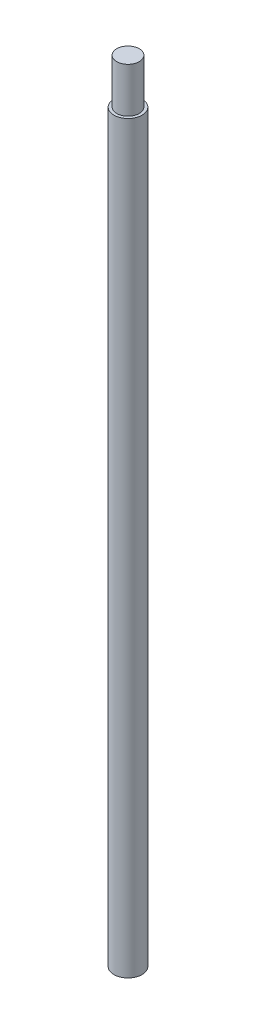
from build123d import *

# Parameters (mm, degrees)
SKETCH_1_R          = 5
EXTRUDE_1_DEPTH     = 281
SKETCH_2_R          = 16
SKETCH_2_R_2        = 4
CUT_EXTRUDE_1_DEPTH = 16


with BuildPart() as part:
    # 스케치1 → 보스-돌출1 (new body)
    with BuildSketch(Plane(origin=(0, 0, 0), x_dir=(1, 0, 0), z_dir=(0, 1, 0))):
        with Locations(Location((0, 0, 0), (0, 0, 270))):
            Circle(SKETCH_1_R)
    extrude(amount=EXTRUDE_1_DEPTH)

    # 스케치2 → 컷-돌출1 (cut)
    with BuildSketch(Plane(origin=(0, 281, 0), x_dir=(1, 0, 0), z_dir=(0, 1, 0))):
        Circle(SKETCH_2_R)
        with Locations(Location((0, 0, 0), (0, 0, 270))):
            Circle(SKETCH_2_R_2, mode=Mode.SUBTRACT)
    extrude(amount=-CUT_EXTRUDE_1_DEPTH, mode=Mode.SUBTRACT)


solid = part.part
